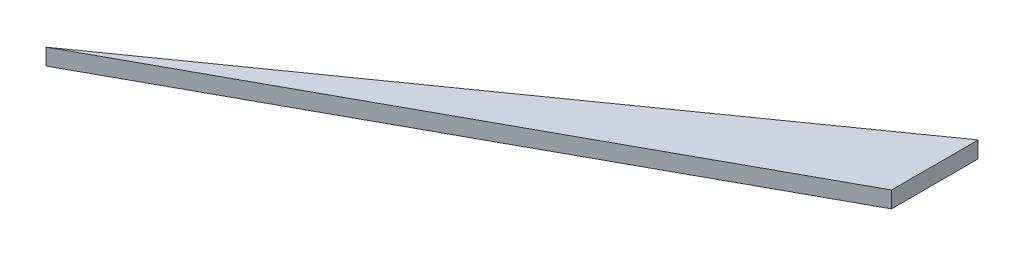
from build123d import *

# Parameters (mm, degrees)
SKETCH1_W           = 263.3434916
SKETCH1_H           = 204.19140391
BOSS_EXTRUDE1_DEPTH = 4.599999944
SKETCH3_OUTSIDE_W   = 331.995
SKETCH3_OUTSIDE_H   = 272.843
CUT_EXTRUDE2_DEPTH  = 334.264285513


with BuildPart() as part:
    # Sketch1 → Boss-Extrude1 (new body)
    with BuildSketch(Plane(origin=(0, 0, 0), x_dir=(1, 0, 0), z_dir=(0, 1, 0))):
        with Locations((131.6717458, 102.095701955)):
            Rectangle(SKETCH1_W, SKETCH1_H)
    extrude(amount=BOSS_EXTRUDE1_DEPTH)

    # Sketch3 outside → Cut-Extrude2 (cut, through all)
    with BuildSketch(Plane.XZ):
        with Locations((131.6715, -102.0955)):
            Rectangle(SKETCH3_OUTSIDE_W, SKETCH3_OUTSIDE_H)
        Polygon((263.3016846, -127.791527081), (263.3434916, -127.749354997), (263.3434916, -103.437038366), (109.628340472, -19.314530099), align=None, mode=Mode.SUBTRACT)
    extrude(amount=-CUT_EXTRUDE2_DEPTH, mode=Mode.SUBTRACT)


solid = part.part
